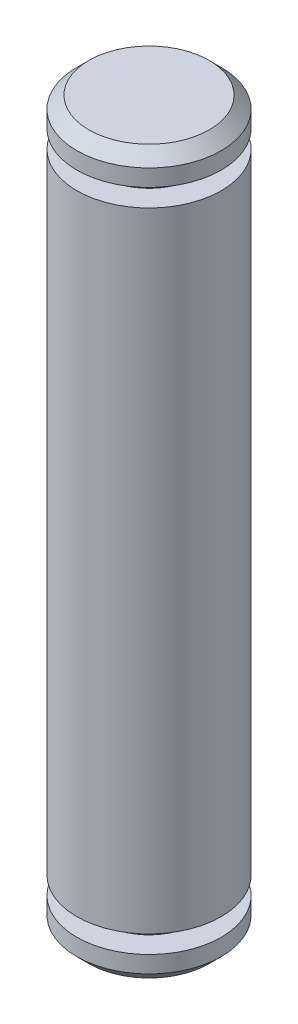
from build123d import *

# Parameters (mm, degrees)
SKETCH1_R           = 3
BOSS_EXTRUDE1_DEPTH = 30
SKETCH2_W           = 1
SKETCH2_H           = 0.74
CHAMFER1_SIZE       = 0.5


with BuildPart() as part:
    # Sketch1 → Boss-Extrude1 (new body)
    with BuildSketch(Plane(origin=(0, 0, 0), x_dir=(1, 0, 0), z_dir=(0, 1, 0))):
        with Locations(Location((0, 0, 0), (0, 0, 270))):
            Circle(SKETCH1_R)
    extrude(amount=BOSS_EXTRUDE1_DEPTH)

    # Sketch2 → Cut-Revolve1 (revolve, cut)
    with BuildSketch(Plane.XY):
        with Locations((2.5, 28.43)):
            Rectangle(SKETCH2_W, SKETCH2_H)
        with Locations((2.5, 1.57)):
            Rectangle(SKETCH2_W, SKETCH2_H)
    revolve(axis=Axis((0, -1000, 0), (0, 1, 0)), mode=Mode.SUBTRACT)

    # Chamfer1
    chamfer1_edges = [part.edges().sort_by_distance(p)[0] for p in [
        (0, 0, -3),
        (0, 30, -3),
    ]]
    chamfer(chamfer1_edges, length=CHAMFER1_SIZE)


solid = part.part
